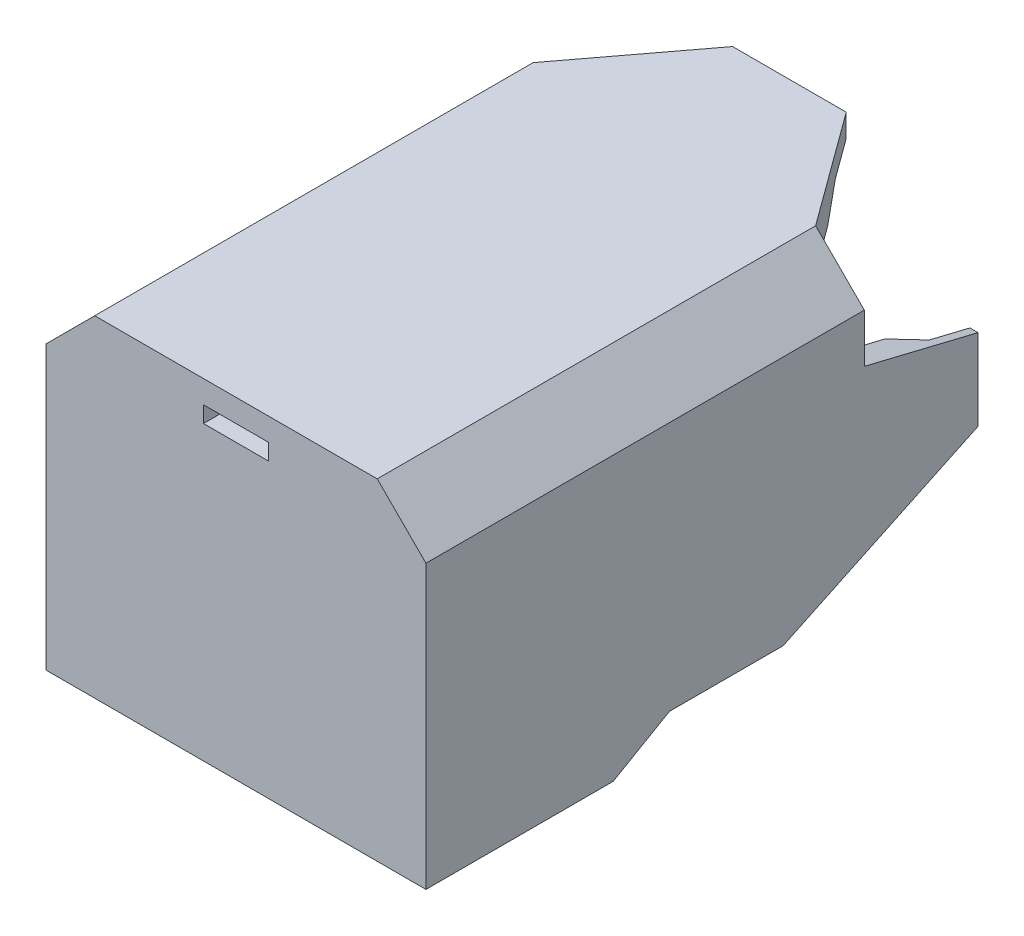
from build123d import *

# Parameters (mm, degrees)
SKETCH_1_W           = 23.4
SKETCH_1_H           = 23.4
EXTRUDE_1_DEPTH      = 38
CUT_EXTRUDE_START    = -4.6
SKETCH_1_3_W         = 20.4
SKETCH_1_3_H         = 17
CUT_EXTRUDE_1_DEPTH  = 37.846109588
CUT_EXTRUDE_START_2  = -1
SKETCH_1_4_W         = 10.2
SKETCH_1_4_H         = 10.2
CUT_EXTRUDE_2_DEPTH  = 41.446109588
CHAMFER_2_SIZE       = 3
CUT_EXTRUDE_3_DEPTH  = 47.135127614
CUT_EXTRUDE_4_REACH  = 46.688
CUT_EXTRUDE_5_DEPTH  = 43.900466198
CUT_EXTRUDE_6_DEPTH  = 42.340657953
SKETCH_10_W          = 4
SKETCH_10_H          = 1
CUT_EXTRUDE_10_DEPTH = 12
HOLE_WIZARD_1_D      = 1.8
HOLE_WIZARD_1_DEPTH  = 3.6


with BuildPart() as part:
    # 草图1 → 凸台-拉伸1 (new body)
    with BuildSketch(Plane.XY):
        Rectangle(SKETCH_1_W, SKETCH_1_H)
    extrude(amount=-EXTRUDE_1_DEPTH)

    # 草图1<3> → 切除-拉伸1 (cut, through all)
    with BuildSketch(Plane.XY.offset(CUT_EXTRUDE_START)):
        with Locations((0, 0.8)):
            Rectangle(SKETCH_1_3_W, SKETCH_1_3_H)
    extrude(amount=-CUT_EXTRUDE_1_DEPTH, mode=Mode.SUBTRACT)

    # 草图1<4> → 切除-拉伸2 (cut, through all)
    with BuildSketch(Plane.XY.offset(CUT_EXTRUDE_START_2)):
        Rectangle(SKETCH_1_4_W, SKETCH_1_4_H)
    extrude(amount=-CUT_EXTRUDE_2_DEPTH, mode=Mode.SUBTRACT)

    # 倒角2
    chamfer_2_edges = [part.edges().sort_by_distance(p)[0] for p in [
        (-11.7, 11.7, -19),
        (11.7, 11.7, -19),
    ]]
    chamfer(chamfer_2_edges, length=CHAMFER_2_SIZE)

    # 草图4 → 切除-拉伸3 (cut, through all)
    with BuildSketch(Plane(origin=(11.7, 0, 0), x_dir=(0, 0, -1), z_dir=(1, 0, 0))):
        Polygon((0, -11.7), (38, -11.7), (38, 8.7), (27, 8.7), (27, 5.7), (34, 4), (34, -1), (22, -6.7), (15, -6.7), (15, -8.7), (11.535898385, -8.7), (0, -8.7), align=None)
        Polygon((15, -6.7), (11.535898385, -8.7), (15, -8.7), align=None)
    extrude(amount=-CUT_EXTRUDE_3_DEPTH, mode=Mode.SUBTRACT)

    # 草图5 → 切除-拉伸4 (cut, up to next)
    with BuildSketch(Plane(origin=(0, 11.7, 0), x_dir=(1, 0, 0), z_dir=(0, 1, 0)), mode=Mode.PRIVATE) as cut_extrude_4_sk1:
        Polygon((-11.7, 27), (-8.7, 27), (-3.414837489, 34), (3.585162511, 34), (8.7, 27), (11.7, 27), (11.7, 38), (-11.7, 38), align=None)
    cut_extrude_4_tool1 = extrude(cut_extrude_4_sk1.sketch, amount=-CUT_EXTRUDE_4_REACH, mode=Mode.PRIVATE) & part.part
    add(cut_extrude_4_tool1.solids().sort_by_distance((-10.2, 11.7, -27.258565))[0], mode=Mode.SUBTRACT)

    # 草图6 → 切除-拉伸5 (cut, through all)
    with BuildSketch(Plane(origin=(11.7, 0, 0), x_dir=(0, 0, -1), z_dir=(1, 0, 0))):
        Polygon((29.767949192, 9.3), (31.5, 10.3), (34, 10.3), (34, 9.3), align=None)
    extrude(amount=-CUT_EXTRUDE_5_DEPTH, mode=Mode.SUBTRACT)

    # 草图7 → 切除-拉伸6 (cut, through all)
    with BuildSketch(Plane(origin=(0, 11.7, 0), x_dir=(1, 0, 0), z_dir=(0, 1, 0))):
        Polygon((-11.2, 34), (-10.2, 34), (-10.2, 29.767949192), (-11.2, 31.5), align=None)
        Polygon((10.2, 34), (10.2, 29.767949192), (11.2, 31.5), (11.2, 34), align=None)
    extrude(amount=-CUT_EXTRUDE_6_DEPTH, mode=Mode.SUBTRACT)

    # 草图10 → 切除-拉伸10 (cut)
    with BuildSketch(Plane.XY):
        with Locations((0, 9.8)):
            Rectangle(SKETCH_10_W, SKETCH_10_H)
    extrude(amount=-CUT_EXTRUDE_10_DEPTH, mode=Mode.SUBTRACT)

    # 孔1
    with Locations(Plane(origin=(0, -8.7, 0), x_dir=(-1, 0, 0), z_dir=(0, -1, 0))):
        with Locations((0, 2.3)):
            Hole(HOLE_WIZARD_1_D / 2, depth=HOLE_WIZARD_1_DEPTH)


solid = part.part
